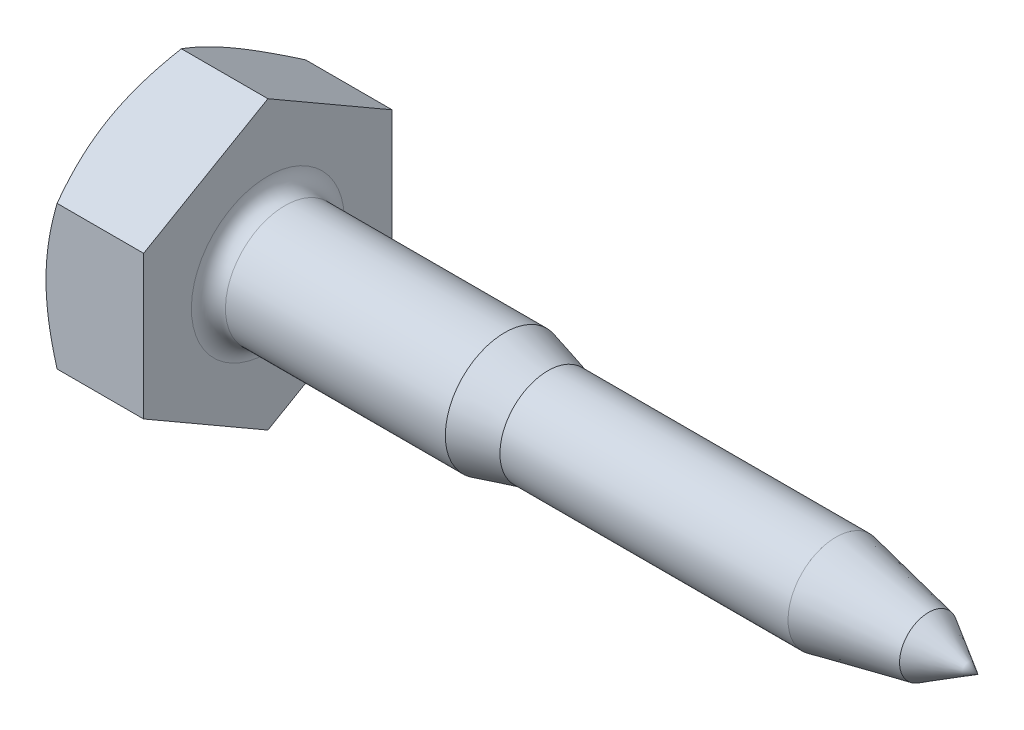
from build123d import *

# Parameters (mm, degrees)
BOSS_EXTRUDE2_START = -20.240625
BOSS_EXTRUDE2_DEPTH = 4.365625
SKETCH16_OUTSIDE_W  = 153.074
SKETCH16_OUTSIDE_H  = 154.794
SKETCH16_OUTSIDE_R  = 5.55625
CUT_EXTRUDE7_DEPTH  = 38.099499124
CUT_EXTRUDE7_DRAFT  = -60
FILLET1_R           = 0.762


with BuildPart() as part:
    # Sketch6 → Revolve1 (revolve)
    with BuildSketch(Plane.XY, mode=Mode.PRIVATE) as revolve1_sk:
        Polygon((9.525, 2.143125), (-3.357695036, 2.143125), (-5.2832, 2.6590625), (-15.875, 2.6590625), (-15.875, 5.55625), (-20.240625, 5.55625), (-20.240625, 0), (15.875, 0), (13.663446892, 1.295930736), align=None)
    revolve(revolve1_sk.sketch.rotate(Axis((-20.240625, 0, 0), (1, 0, 0)), 180), axis=Axis((-20.240625, 0, 0), (1, 0, 0)))

    # Sketch15 → Boss-Extrude2 (add)
    with BuildSketch(Plane(origin=(0, 0, 0), x_dir=(0, 0, -1), z_dir=(1, 0, 0)).offset(BOSS_EXTRUDE2_START)):
        Polygon((0, 6.415804866), (-5.55625, 3.207902433), (-5.55625, -3.207902433), (0, -6.415804866), (5.55625, -3.207902433), (5.55625, 3.207902433), align=None)
    extrude(amount=BOSS_EXTRUDE2_DEPTH)


with BuildPart() as cut_extrude7_tool:
    # Sketch16 outside → Cut-Extrude7 (with draft: the straight prism first)
    with BuildSketch(Plane.ZY.offset(20.240625)):
        Rectangle(SKETCH16_OUTSIDE_W, SKETCH16_OUTSIDE_H)
        Circle(SKETCH16_OUTSIDE_R, mode=Mode.SUBTRACT)
    extrude(amount=-CUT_EXTRUDE7_DEPTH)
    # Cut-Extrude7: the draft: its side faces are tilted about the plane it starts from
    cut_extrude7_sides = [cut_extrude7_tool.faces().sort_by_distance(p)[0] for p in [
        (-1.190875438, -77.397, 0),
        (-1.190875438, 0, 76.537),
        (-1.190875438, 77.397, 0),
        (-1.190875438, 0, -76.537),
        (-1.190875438, 0, -5.55625),
    ]]
    draft(cut_extrude7_sides, Plane.ZY.offset(20.240625), CUT_EXTRUDE7_DRAFT)


with BuildPart() as part_1:
    add(part.part)

    # Cut-Extrude7: cut by cut_extrude7_tool
    add(cut_extrude7_tool.part, mode=Mode.SUBTRACT)

    # Fillet1
    fillet1_edges = [part_1.edges().sort_by_distance(p)[0] for p in [
        (-15.875, 2.6590625, 0),
    ]]
    fillet(fillet1_edges, radius=FILLET1_R)


solid = part_1.part
